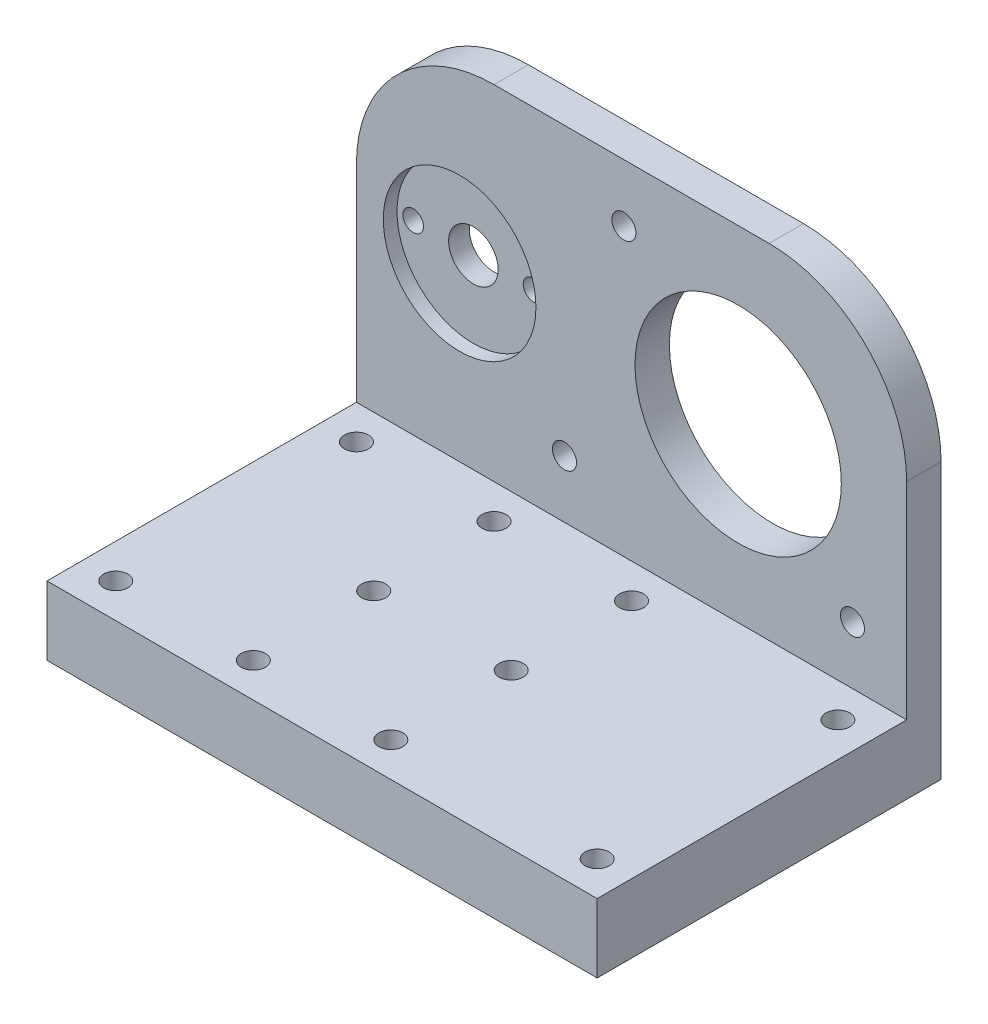
from build123d import *

# Parameters (mm, degrees)
SKETCH1_W               = 80
SKETCH1_H               = 50
BOSS_EXTRUDE1_DEPTH     = 5
SKETCH2_R               = 3.6
CUT_EXTRUDE1_DEPTH      = 123.886126149
SKETCH3_R               = 1.5
CUT_EXTRUDE2_DEPTH      = 123.886126149
SKETCH4_R               = 11.1
CUT_EXTRUDE3_DEPTH      = 2
SKETCH5_R               = 15
CUT_EXTRUDE4_DEPTH      = 123.886126149
SKETCH6_R               = 1.75
CUT_EXTRUDE5_DEPTH      = 123.886126149
SKETCH7_W               = 80
SKETCH7_H               = 50
BOSS_EXTRUDE2_DEPTH     = 10
FILLET1_R               = 20
CUT_EXTRUDE6_DEPTH      = 140.283882772
CUT_EXTRUDE6_DEPTH_BACK = 140.283882772
SKETCH9_R               = 1.75
SKETCH10_R              = 1.75
CUT_EXTRUDE7_DEPTH      = 140.283882772
SKETCH11_R              = 1.75
CUT_EXTRUDE8_DEPTH      = 134.120246394


with BuildPart() as part:
    # Sketch1 → Boss-Extrude1 (new body)
    with BuildSketch(Plane.XY):
        with Locations((-80, -1)):
            Rectangle(SKETCH1_W, SKETCH1_H)
    extrude(amount=BOSS_EXTRUDE1_DEPTH)

    # Sketch2 → Cut-Extrude1 (cut, through all)
    with BuildSketch(Plane.XY.offset(5)):
        with Locations((-105, -1)):
            Circle(SKETCH2_R)
    extrude(amount=-CUT_EXTRUDE1_DEPTH, mode=Mode.SUBTRACT)

    # Sketch3 → Cut-Extrude2 (cut, through all)
    with BuildSketch(Plane.XY.offset(5)):
        with Locations((-96.25, -1)):
            Circle(SKETCH3_R)
        with Locations((-113.75, -1)):
            Circle(SKETCH3_R)
    extrude(amount=-CUT_EXTRUDE2_DEPTH, mode=Mode.SUBTRACT)

    # Sketch4 → Cut-Extrude3 (cut)
    with BuildSketch(Plane.XY.offset(5)):
        with Locations((-105, -1)):
            Circle(SKETCH4_R)
    extrude(amount=-CUT_EXTRUDE3_DEPTH, mode=Mode.SUBTRACT)

    # Sketch5 → Cut-Extrude4 (cut, through all)
    with BuildSketch(Plane.XY.offset(5)):
        with Locations((-64.5, -1)):
            Circle(SKETCH5_R)
    extrude(amount=-CUT_EXTRUDE4_DEPTH, mode=Mode.SUBTRACT)

    # Sketch6 → Cut-Extrude5 (cut, through all)
    with BuildSketch(Plane.XY.offset(5)):
        with Locations((-81.117009358, 15.617009358)):
            Circle(SKETCH6_R)
        with Locations((-47.882990642, -17.617009358)):
            Circle(SKETCH6_R)
    extrude(amount=-CUT_EXTRUDE5_DEPTH, mode=Mode.SUBTRACT)

    # Sketch7 → Boss-Extrude2 (add)
    with BuildSketch(Plane.XZ.offset(26)):
        with Locations((-80, 25)):
            Rectangle(SKETCH7_W, SKETCH7_H)
    extrude(amount=BOSS_EXTRUDE2_DEPTH)

    # Fillet1
    fillet1_edges = [part.edges().sort_by_distance(p)[0] for p in [
        (-120, 24, 2.5),
        (-40, 24, 2.5),
    ]]
    fillet(fillet1_edges, radius=FILLET1_R)

    # Sketch9 → Cut-Extrude6 (cut, two sides: drawn at the far end of the back side and taken through both)
    with BuildSketch(Plane(origin=(0, -26, 0), x_dir=(1, 0, 0), z_dir=(0, 1, 0)).offset(-CUT_EXTRUDE6_DEPTH_BACK)):
        with Locations(Location((-115, -10, 0), (0, 0, 270))):
            Circle(SKETCH9_R)
        with Locations(Location((-45, -10, 0), (0, 0, 270))):
            Circle(SKETCH9_R)
        with Locations(Location((-45, -45, 0), (0, 0, 270))):
            Circle(SKETCH9_R)
        with Locations(Location((-115, -45, 0), (0, 0, 270))):
            Circle(SKETCH9_R)
        with Locations(Location((-95, -10, 0), (0, 0, 270))):
            Circle(SKETCH9_R)
        with Locations(Location((-95, -45, 0), (0, 0, 270))):
            Circle(SKETCH9_R)
        with Locations(Location((-75, -10, 0), (0, 0, 270))):
            Circle(SKETCH9_R)
        with Locations(Location((-75, -45, 0), (0, 0, 270))):
            Circle(SKETCH9_R)
    extrude(amount=CUT_EXTRUDE6_DEPTH + CUT_EXTRUDE6_DEPTH_BACK, mode=Mode.SUBTRACT)

    # Sketch10 → Cut-Extrude7 (cut, through all)
    with BuildSketch(Plane(origin=(0, -26, 0), x_dir=(1, 0, 0), z_dir=(0, 1, 0))):
        with Locations(Location((-95, -27.5, 0), (0, 0, 270))):
            Circle(SKETCH10_R)
        with Locations(Location((-75, -27.5, 0), (0, 0, 270))):
            Circle(SKETCH10_R)
    extrude(amount=-CUT_EXTRUDE7_DEPTH, mode=Mode.SUBTRACT)

    # Sketch11 → Cut-Extrude8 (cut, through all)
    with BuildSketch(Plane.XY.offset(5)):
        with Locations((-89.75, -17.617009358)):
            Circle(SKETCH11_R)
    extrude(amount=-CUT_EXTRUDE8_DEPTH, mode=Mode.SUBTRACT)


solid = part.part
